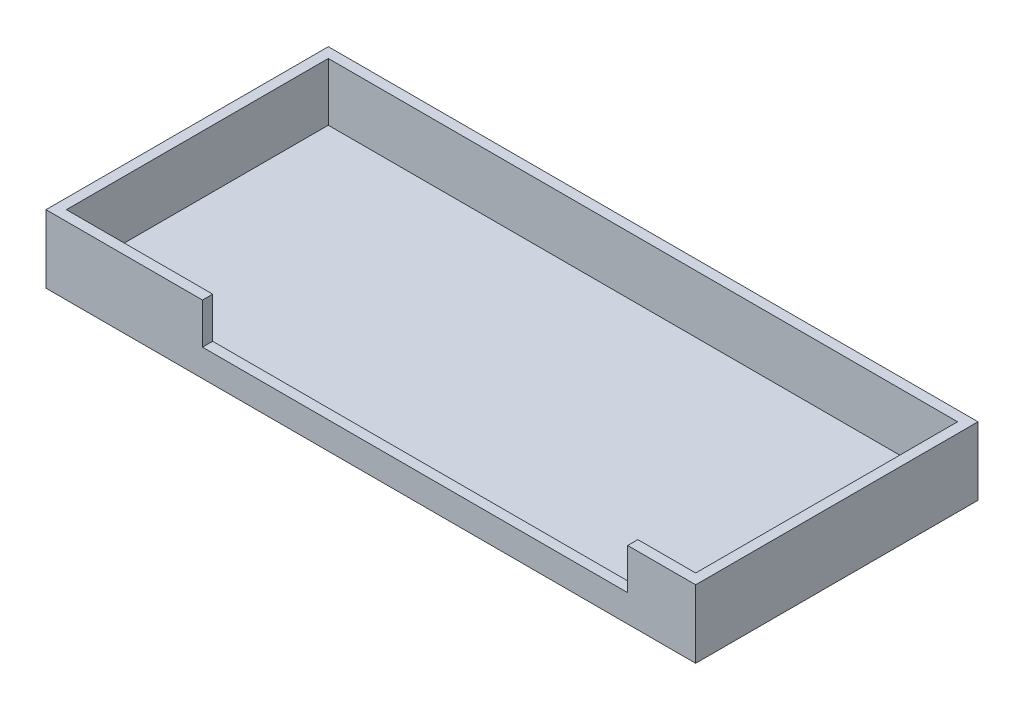
from build123d import *

# Parameters (mm, degrees)
SKETCH1_W           = 191
SKETCH1_H           = 83
BOSS_EXTRUDE2_DEPTH = 20
SKETCH3_W           = 185
SKETCH3_H           = 77
CUT_EXTRUDE2_DEPTH  = 17
SKETCH5_W           = 125
SKETCH5_H           = 21.405857205
CUT_EXTRUDE3_DEPTH  = 17


with BuildPart() as part:
    # Sketch1 → Boss-Extrude2 (new body)
    with BuildSketch(Plane(origin=(0, 0, 0), x_dir=(1, 0, 0), z_dir=(0, 1, 0))):
        Rectangle(SKETCH1_W, SKETCH1_H)
    extrude(amount=BOSS_EXTRUDE2_DEPTH)

    # Sketch3 → Cut-Extrude2 (cut)
    with BuildSketch(Plane(origin=(0, 20, 0), x_dir=(1, 0, 0), z_dir=(0, 1, 0))):
        Rectangle(SKETCH3_W, SKETCH3_H)
    extrude(amount=-CUT_EXTRUDE2_DEPTH, mode=Mode.SUBTRACT)

    # Sketch5 → Cut-Extrude3 (cut)
    with BuildSketch(Plane.XY.offset(41.5)):
        with Locations((13, 18.697690384)):
            Rectangle(SKETCH5_W, SKETCH5_H)
    extrude(amount=-CUT_EXTRUDE3_DEPTH, mode=Mode.SUBTRACT)


solid = part.part
